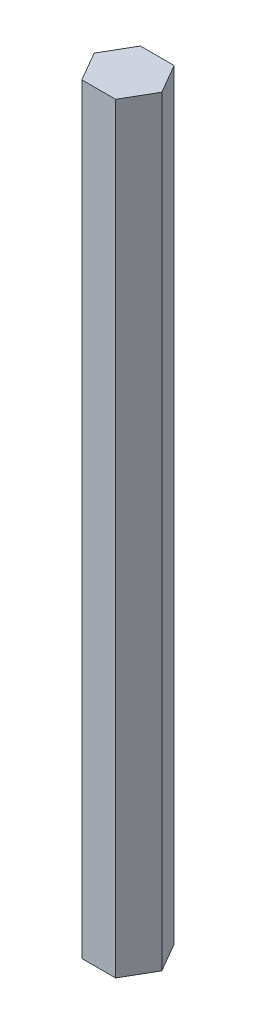
from build123d import *

# Parameters (mm, degrees)
BOSS_EXTRUDE1_DEPTH = 165.1


with BuildPart() as part:
    # Sketch1 → Boss-Extrude1 (new body)
    with BuildSketch(Plane(origin=(0, 0, 0), x_dir=(1, 0, 0), z_dir=(0, 1, 0))):
        Polygon((7.332348419, 0), (3.666174209, 6.35), (-3.666174209, 6.35), (-7.332348419, 0), (-3.666174209, -6.35), (3.666174209, -6.35), align=None)
    extrude(amount=BOSS_EXTRUDE1_DEPTH)


solid = part.part
